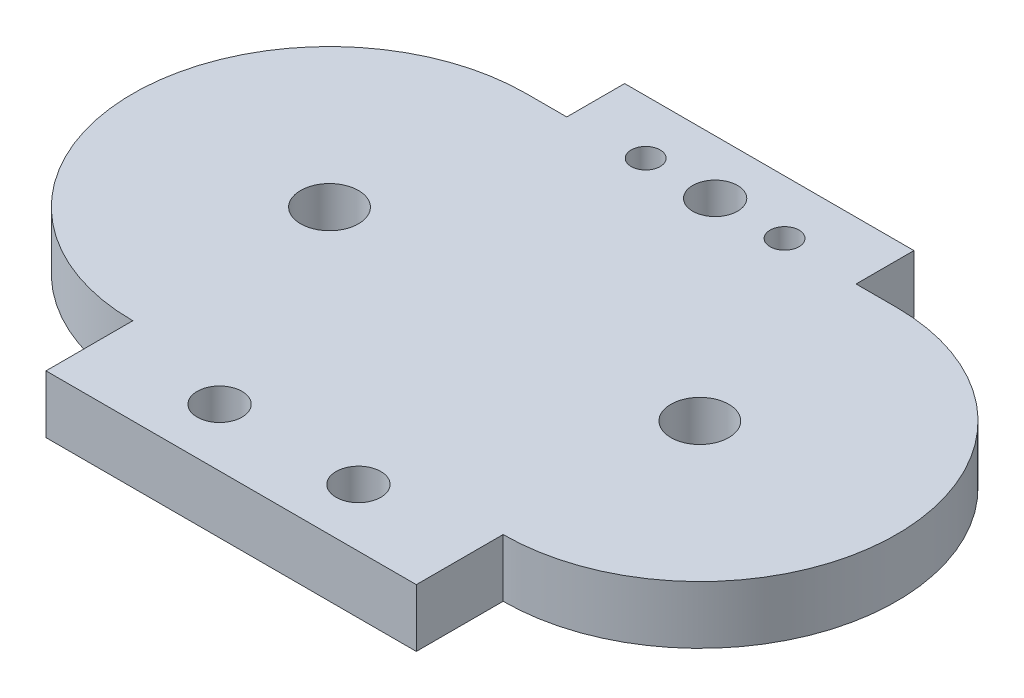
from build123d import *

# Parameters (mm, degrees)
SKETCH1_R                    = 3.175
SKETCH1_R_2                  = 1.5875
BOSS_EXTRUDE1_DEPTH          = 6.35
F_10_0_1935_DIAMETER_HOLE1_D = 4.9149


with BuildPart() as part:
    # Sketch1 → Boss-Extrude1 (new body)
    with BuildSketch(Plane(origin=(0, 0, 0), x_dir=(1, 0, 0), z_dir=(0, 1, 0))):
        with BuildLine():
            Line((-20.32, 21.59), (-15.875, 21.59))
            Line((-15.875, 21.59), (-15.875, 27.94))
            Line((-15.875, 27.94), (15.875, 27.94))
            Line((15.875, 27.94), (15.875, 21.59))
            Line((15.875, 21.59), (20.32, 21.59))
            ThreePointArc((20.32, 21.59), (41.91, 0), (20.32, -21.59))
            Line((20.32, -21.59), (20.32, -31.115))
            Line((20.32, -31.115), (-20.32, -31.115))
            Line((-20.32, -31.115), (-20.32, -21.59))
            ThreePointArc((-20.32, -21.59), (-41.91, 0), (-20.32, 21.59))
        make_face()
        with Locations(Location((20.32, 0, 0), (0, 0, 270))):
            Circle(SKETCH1_R, mode=Mode.SUBTRACT)
        with Locations(Location((7.62, 21.997045256, 0), (0, 0, 270))):
            Circle(SKETCH1_R_2, mode=Mode.SUBTRACT)
        with Locations(Location((-20.32, 0, 0), (0, 0, 270))):
            Circle(SKETCH1_R, mode=Mode.SUBTRACT)
        with Locations(Location((-7.62, 21.997045256, 0), (0, 0, 270))):
            Circle(SKETCH1_R_2, mode=Mode.SUBTRACT)
    extrude(amount=BOSS_EXTRUDE1_DEPTH)

    # #10 (0.1935) Diameter Hole1 (through all)
    with Locations(Plane(origin=(0, 6.35, 0), x_dir=(1, 0, 0), z_dir=(0, 1, 0))):
        with Locations((0, 21.997045256), (-7.62, -24.765), (7.62, -24.765)):
            Hole(F_10_0_1935_DIAMETER_HOLE1_D / 2)


solid = part.part
